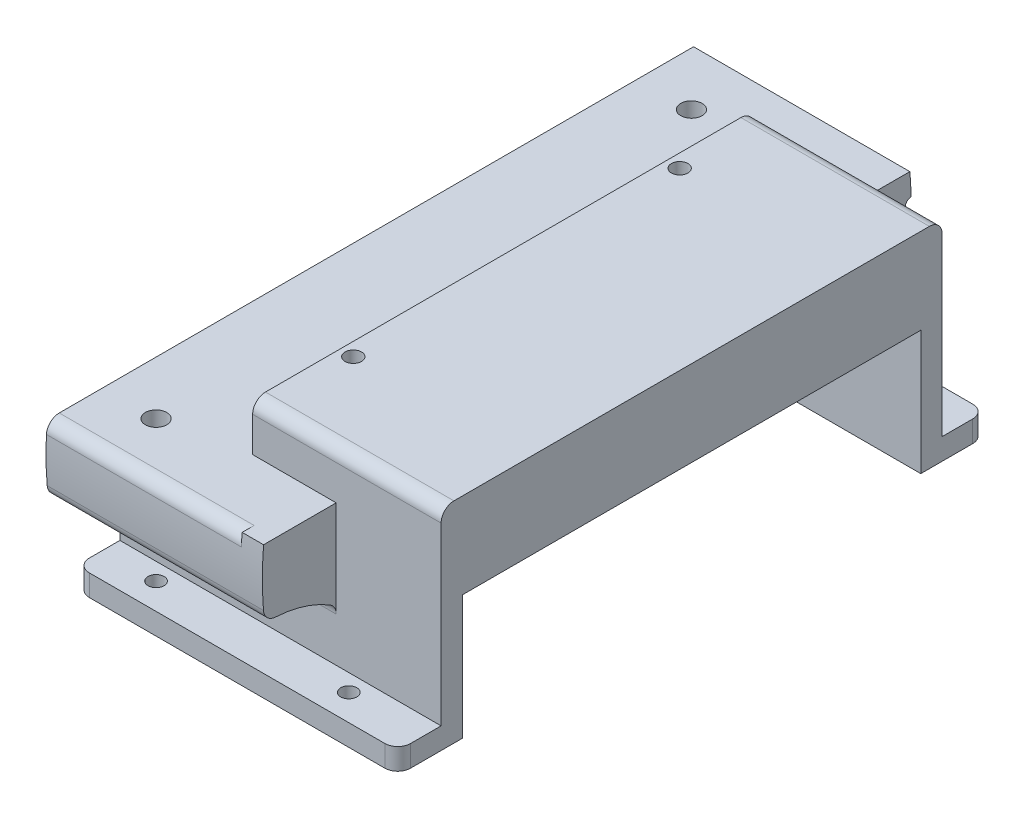
from build123d import *

# Parameters (mm, degrees)
BOSS_EXTRUDE1_START = 15
BOSS_EXTRUDE1_DEPTH = 75
SKETCH2_W           = 107
SKETCH2_H           = 29
CUT_EXTRUDE1_DEPTH  = 123.079123932
CUT_EXTRUDE12_START = -29.5
CUT_EXTRUDE12_DEPTH = 29.5
SKETCH16_R          = 1.875
CUT_EXTRUDE13_DEPTH = 5
SKETCH17_W          = 46
SKETCH17_H          = 117
CUT_EXTRUDE14_DEPTH = 11.15
SKETCH14_R          = 1.93
CUT_EXTRUDE10_DEPTH = 6.5
FILLET1_R           = 3
BOSS_EXTRUDE3_DEPTH = 5
SKETCH21_R          = 1.375
CUT_EXTRUDE15_DEPTH = 50.5
SKETCH22_R          = 2.5
CUT_EXTRUDE16_DEPTH = 32.85
SKETCH23_R          = 1.93
CUT_EXTRUDE17_DEPTH = 4


with BuildPart() as part:
    # Sketch1 → Boss-Extrude1 (new body)
    with BuildSketch(Plane(origin=(0, 0, 0), x_dir=(0, 0, -1), z_dir=(1, 0, 0)).offset(BOSS_EXTRUDE1_START)):
        with BuildLine():
            Line((-68.626974957, 15.5), (-58.5, 15.5))
            Line((-58.5, 15.5), (-58.5, 27.48087198))
            ThreePointArc((-58.5, 27.48087198), (-66.444952459, 31.270691326), (-75.182099647, 32.341793222))
            ThreePointArc((-75.182099647, 32.341793222), (-75.739500667, 40.338834406), (-75.44865804, 48.35))
            Line((-75.44865804, 48.35), (-58.5, 48.35))
            Line((-58.5, 48.35), (-58.5, 59.5))
            Line((-58.5, 59.5), (58.5, 59.5))
            Line((58.5, 59.5), (58.5, 48.35))
            Line((58.5, 48.35), (75.44865804, 48.35))
            ThreePointArc((75.44865804, 48.35), (75.739500667, 40.338834406), (75.182099647, 32.341793222))
            ThreePointArc((75.182099647, 32.341793222), (66.444952459, 31.270691326), (58.5, 27.48087198))
            Line((58.5, 27.48087198), (58.5, 15.5))
            Line((58.5, 15.5), (68.626974957, 15.5))
            Line((68.626974957, 15.5), (68.626974957, 10.5))
            Line((68.626974957, 10.5), (-68.626974957, 10.5))
            Line((-68.626974957, 10.5), (-68.626974957, 15.5))
        make_face()
    extrude(amount=BOSS_EXTRUDE1_DEPTH)

    # Sketch2 → Cut-Extrude1 (cut, through all)
    with BuildSketch(Plane(origin=(90, 0, 0), x_dir=(0, 0, -1), z_dir=(1, 0, 0))):
        with Locations((0, 25)):
            Rectangle(SKETCH2_W, SKETCH2_H)
    extrude(amount=-CUT_EXTRUDE1_DEPTH, mode=Mode.SUBTRACT)

    # Sketch9 → Cut-Extrude12 (cut)
    with BuildSketch(Plane(origin=(90, 0, 0), x_dir=(0, 0, -1), z_dir=(1, 0, 0)).offset(CUT_EXTRUDE12_START)):
        with BuildLine():
            Line((-58.5, 27.48087198), (-58.5, 48.35))
            Line((-58.5, 48.35), (-75.44865804, 48.35))
            ThreePointArc((-75.44865804, 48.35), (-75.739500667, 40.338834406), (-75.182099647, 32.341793222))
            ThreePointArc((-75.182099647, 32.341793222), (-66.444952459, 31.270691326), (-58.5, 27.48087198))
        make_face()
        with BuildLine():
            Line((58.5, 27.48087198), (58.5, 48.35))
            Line((58.5, 48.35), (75.44865804, 48.35))
            ThreePointArc((75.44865804, 48.35), (75.739500667, 40.338834406), (75.182099647, 32.341793222))
            ThreePointArc((75.182099647, 32.341793222), (66.444952459, 31.270691326), (58.5, 27.48087198))
        make_face()
    extrude(amount=CUT_EXTRUDE12_DEPTH, mode=Mode.SUBTRACT)

    # Sketch16 → Cut-Extrude13 (cut)
    with BuildSketch(Plane.XZ.offset(-10.5)):
        with Locations(Location((27.45, -62.5, 0), (0, 0, 270))):
            Circle(SKETCH16_R)
        with Locations(Location((72.45, -62.5, 0), (0, 0, 270))):
            Circle(SKETCH16_R)
    cut_extrude13 = extrude(amount=-CUT_EXTRUDE13_DEPTH, mode=Mode.SUBTRACT)

    # Mirror2: Cut-Extrude13 across plane
    add(cut_extrude13.mirror(Plane.XY), mode=Mode.SUBTRACT)

    # Sketch17 → Cut-Extrude14 (cut)
    with BuildSketch(Plane(origin=(0, 59.5, 0), x_dir=(1, 0, 0), z_dir=(0, 1, 0))):
        with Locations((23, 0)):
            Rectangle(SKETCH17_W, SKETCH17_H)
    extrude(amount=-CUT_EXTRUDE14_DEPTH, mode=Mode.SUBTRACT)

    # Sketch14 → Cut-Extrude10 (cut)
    with BuildSketch(Plane(origin=(0, 59.5, 0), x_dir=(1, 0, 0), z_dir=(0, 1, 0))):
        with Locations(Location((49.1, 38.1, 0), (0, 0, 270))):
            Circle(SKETCH14_R)
        with Locations(Location((49.1, -38.1, 0), (0, 0, 270))):
            Circle(SKETCH14_R)
    extrude(amount=-CUT_EXTRUDE10_DEPTH, mode=Mode.SUBTRACT)

    # Fillet1
    fillet1_edges = [part.edges().sort_by_distance(p)[0] for p in [
        (90, 13, 68.626974957),
        (15, 13, -68.626974957),
        (15, 13, 68.626974957),
        (68, 59.5, 58.5),
        (68, 59.5, -58.5),
        (90, 13, -68.626974957),
        (37.75, 32.341793222, 75.182099647),
        (37.75, 48.35, 75.44865804),
        (37.75, 32.341793222, -75.182099647),
        (37.75, 27.48087198, -58.5),
        (37.75, 27.48087198, 58.5),
    ]]
    fillet(fillet1_edges, radius=FILLET1_R)

    # Sketch20 → Boss-Extrude3 (add)
    with BuildSketch(Plane(origin=(60.5, 0, 0), x_dir=(0, 0, -1), z_dir=(1, 0, 0))):
        with BuildLine():
            Line((75.44865804, 48.35), (58.5, 48.35))
            Line((58.5, 48.35), (58.5, 25.852098922))
            ThreePointArc((58.5, 25.852098922), (58.887094237, 27.326115025), (59.948482315, 28.41974237))
            ThreePointArc((59.948482315, 28.41974237), (66.053139575, 31.15333873), (72.638618282, 32.324175832))
            ThreePointArc((72.638618282, 32.324175832), (74.564449947, 33.163853344), (75.467231088, 35.060922699))
            ThreePointArc((75.467231088, 35.060922699), (75.749926018, 41.705869428), (75.44865804, 48.35))
        make_face()
    boss_extrude3 = extrude(amount=BOSS_EXTRUDE3_DEPTH)

    # Mirror4: Boss-Extrude3 across plane
    add(boss_extrude3.mirror(Plane.XY))

    # Sketch21 → Cut-Extrude15 (cut)
    with BuildSketch(Plane(origin=(65.5, 0, 0), x_dir=(0, 0, -1), z_dir=(1, 0, 0))):
        with Locations((75.749926018, 41.705869428)):
            Circle(SKETCH21_R)
    extrude(amount=-CUT_EXTRUDE15_DEPTH, mode=Mode.SUBTRACT)

    # Sketch22 → Cut-Extrude16 (cut)
    with BuildSketch(Plane(origin=(0, 15.5, 0), x_dir=(1, 0, 0), z_dir=(0, 1, 0))):
        with Locations(Location((27.45, -62.5, 0), (0, 0, 90))):
            Circle(SKETCH22_R)
    cut_extrude16 = extrude(amount=CUT_EXTRUDE16_DEPTH, mode=Mode.SUBTRACT)

    # Mirror5: Cut-Extrude16 across plane
    add(cut_extrude16.mirror(Plane.XY), mode=Mode.SUBTRACT)

    # Sketch23 → Cut-Extrude17 (cut)
    with BuildSketch(Plane(origin=(46, 2.35, 0), x_dir=(0, 1, 0), z_dir=(-1, 0, 0))):
        with Locations(Location((55.15, 54.5, 0), (0, 0, 270))):
            Circle(SKETCH23_R)
        with Locations(Location((55.15, -54.5, 0), (0, 0, 270))):
            Circle(SKETCH23_R)
    extrude(amount=-CUT_EXTRUDE17_DEPTH, mode=Mode.SUBTRACT)


solid = part.part
